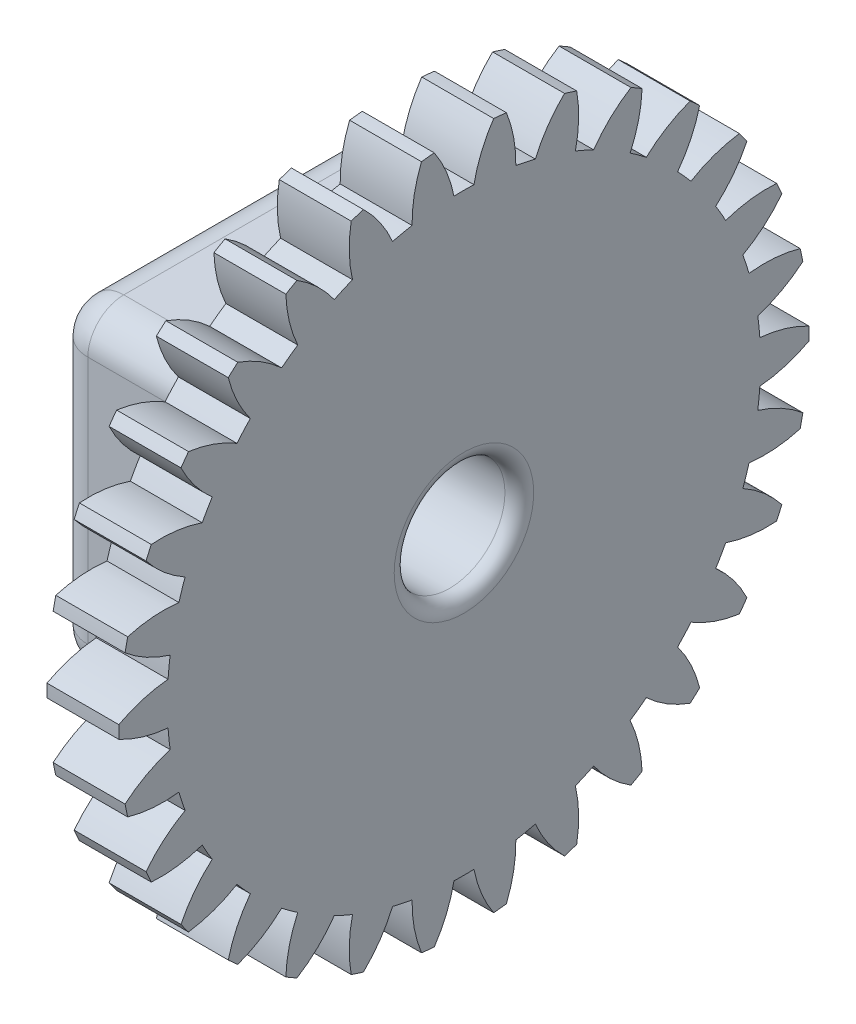
from build123d import *

# Parameters (mm, degrees)
BASPROSKE_W         = 10
BASPROSKE_H         = 48
TOOTHCUT_DEPTH      = 69.614867194
TEETHCUTS_COUNT     = 30
TEETHCUTS_ANGLE     = 348
BORSKE_R            = 5
BORE_DEPTH          = 50.0000508
SKETCH2_W           = 44.6
SKETCH2_H           = 44.6
BOSS_EXTRUDE1_DEPTH = 60
CUT_EXTRUDE1_REACH  = 99.421
SKETCH1_R           = 7.7
CUT_EXTRUDE2_REACH  = 106.024
SKETCH3_W           = 35
SKETCH3_H           = 44.6
FILLET1_R           = 2
FILLET2_R           = 5


with BuildPart() as part:
    # BasProSke → Base-Revolve (revolve)
    with BuildSketch(Plane(origin=(0, 0, 0), x_dir=(1, 0, 0), z_dir=(0, 1, 0)), mode=Mode.PRIVATE) as base_revolve_sk:
        with Locations((5, 24)):
            Rectangle(BASPROSKE_W, BASPROSKE_H)
    revolve(base_revolve_sk.sketch.rotate(Axis((-10, 0, 0), (1, 0, 0)), 180), axis=Axis((-10, 0, 0), (1, 0, 0)))

    # TooCutSke → ToothCut (cut, through all)
    with BuildSketch(Plane(origin=(0, 0, 0), x_dir=(0, 0, -1), z_dir=(1, 0, 0))):
        with BuildLine():
            ThreePointArc((1.388358102, 41.225628713), (0, 41.249), (-1.388358102, 41.225628713))
            ThreePointArc((-1.388358102, 41.225628713), (-2.434419088, 44.674608087), (-4.146627223, 47.846050285))
            ThreePointArc((-4.146627223, 47.846050285), (0, 48.0254), (4.146627223, 47.846050285))
            ThreePointArc((4.146627223, 47.846050285), (2.434419088, 44.674608087), (1.388358102, 41.225628713))
        make_face()
    toothcut = extrude(amount=TOOTHCUT_DEPTH, mode=Mode.SUBTRACT)

    # TeethCuts: ToothCut ×30 about axis
    teethcuts_axis = Axis((-10, 0, 0), (1, 0, 0))
    for i in range(1, TEETHCUTS_COUNT):
        add(toothcut.rotate(teethcuts_axis, i * TEETHCUTS_ANGLE / (TEETHCUTS_COUNT - 1)), mode=Mode.SUBTRACT)

    # BorSke → Bore (cut, symmetric)
    with BuildSketch(Plane(origin=(0, 0, 0), x_dir=(0, 0, -1), z_dir=(1, 0, 0))):
        with Locations(Location((0, 0, 0), (0, 0, 180))):
            Circle(BORSKE_R)
    extrude(amount=BORE_DEPTH, both=True, mode=Mode.SUBTRACT)

    # Sketch2 → Boss-Extrude1 (add)
    with BuildSketch(Plane.ZY):
        Rectangle(SKETCH2_W, SKETCH2_H)
    extrude(amount=BOSS_EXTRUDE1_DEPTH)

    # Sketch1 → Cut-Extrude1 (cut, up to next)
    with BuildSketch(Plane(origin=(10, 0, 0), x_dir=(0, 0, -1), z_dir=(1, 0, 0)), mode=Mode.PRIVATE) as cut_extrude1_sk1:
        Circle(SKETCH1_R)
    cut_extrude1_tool1 = extrude(cut_extrude1_sk1.sketch, amount=-CUT_EXTRUDE1_REACH, mode=Mode.PRIVATE) & part.part
    add(cut_extrude1_tool1.solids().sort_by_distance((10, 0, 0))[0], mode=Mode.SUBTRACT)

    # Sketch3 → Cut-Extrude2 (cut, up to next)
    with BuildSketch(Plane(origin=(0, 22.3, 0), x_dir=(1, 0, 0), z_dir=(0, 1, 0)), mode=Mode.PRIVATE) as cut_extrude2_sk1:
        with Locations((-42.5, 0)):
            Rectangle(SKETCH3_W, SKETCH3_H)
    cut_extrude2_tool1 = extrude(cut_extrude2_sk1.sketch, amount=-CUT_EXTRUDE2_REACH, mode=Mode.PRIVATE) & part.part
    add(cut_extrude2_tool1.solids().sort_by_distance((-42.5, 22.3, 0))[0], mode=Mode.SUBTRACT)

    # Fillet1
    fillet1_edges = [part.edges().sort_by_distance(p)[0] for p in [
        (10, 0, 7.7),
        (-25, 0, 7.7),
    ]]
    fillet(fillet1_edges, radius=FILLET1_R)

    # Fillet2
    fillet2_edges = [part.edges().sort_by_distance(p)[0] for p in [
        (-12.5, 22.3, -22.3),
        (-12.5, 22.3, 22.3),
        (-12.5, -22.3, 22.3),
        (-12.5, -22.3, -22.3),
        (-25, 0, 22.3),
        (-25, 0, -22.3),
        (-25, 22.3, 0),
        (-25, -22.3, 0),
    ]]
    fillet(fillet2_edges, radius=FILLET2_R)


solid = part.part
